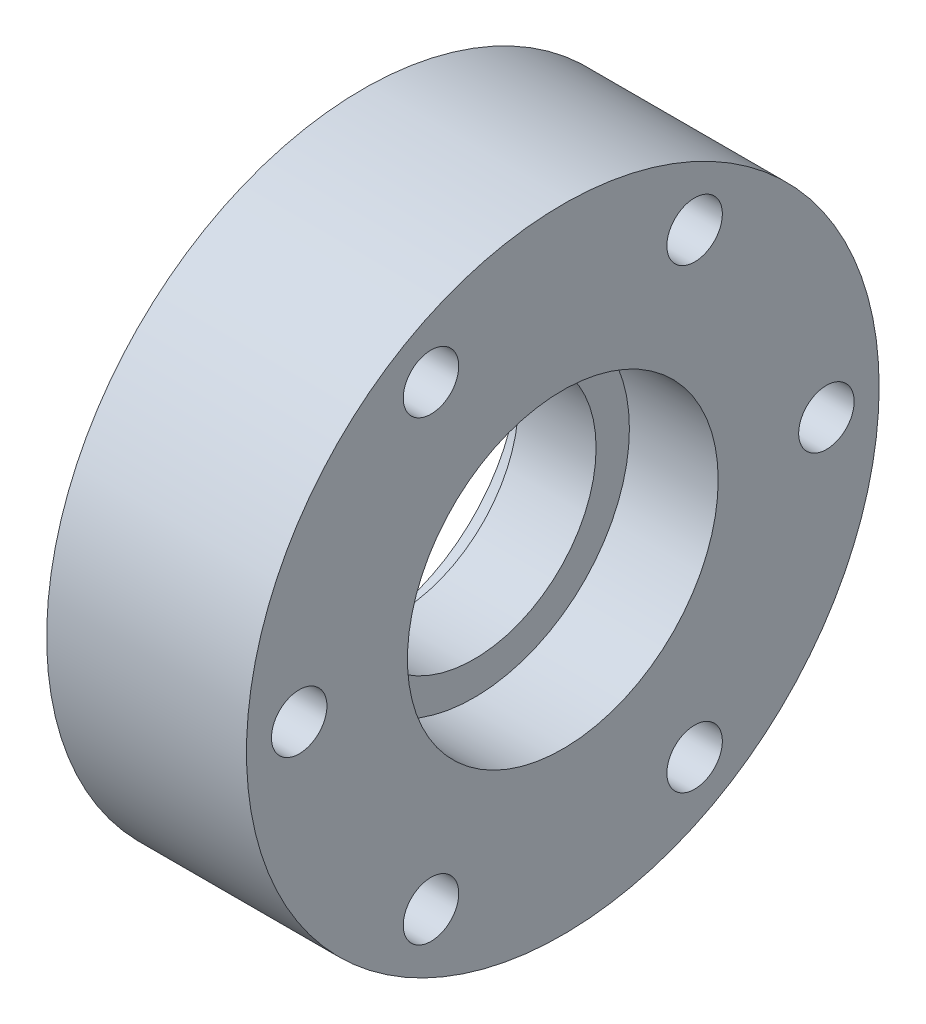
from build123d import *

# Parameters (mm, degrees)
SKETCH1_R           = 28.5
SKETCH1_R_2         = 11
SKETCH1_R_3         = 2.5
BOSS_EXTRUDE1_DEPTH = 18
CUT_EXTRUDE1_START  = -8
SKETCH2_R           = 14
SKETCH2_R_2         = 11
CUT_EXTRUDE1_DEPTH  = 8
SKETCH3_R           = 14
SKETCH3_R_2         = 11
CUT_EXTRUDE2_DEPTH  = 3


with BuildPart() as part:
    # Sketch1 → Boss-Extrude1 (new body)
    with BuildSketch(Plane(origin=(0, 0, 0), x_dir=(0, 0, -1), z_dir=(1, 0, 0))):
        Circle(SKETCH1_R)
        Circle(SKETCH1_R_2, mode=Mode.SUBTRACT)
        with Locations((-23.75, 0)):
            Circle(SKETCH1_R_3, mode=Mode.SUBTRACT)
        with Locations((-11.875, 20.56810334)):
            Circle(SKETCH1_R_3, mode=Mode.SUBTRACT)
        with Locations((11.875, 20.56810334)):
            Circle(SKETCH1_R_3, mode=Mode.SUBTRACT)
        with Locations((23.75, 0)):
            Circle(SKETCH1_R_3, mode=Mode.SUBTRACT)
        with Locations((11.875, -20.56810334)):
            Circle(SKETCH1_R_3, mode=Mode.SUBTRACT)
        with Locations((-11.875, -20.56810334)):
            Circle(SKETCH1_R_3, mode=Mode.SUBTRACT)
    extrude(amount=BOSS_EXTRUDE1_DEPTH)

    # Sketch2 → Cut-Extrude1 (cut)
    with BuildSketch(Plane(origin=(18, 0, 0), x_dir=(0, 0, -1), z_dir=(1, 0, 0)).offset(CUT_EXTRUDE1_START)):
        Circle(SKETCH2_R)
        Circle(SKETCH2_R_2, mode=Mode.SUBTRACT)
    extrude(amount=CUT_EXTRUDE1_DEPTH, mode=Mode.SUBTRACT)

    # Sketch3 → Cut-Extrude2 (cut)
    with BuildSketch(Plane.ZY):
        with Locations(Location((0, 0, 0), (0, 0, 180))):
            Circle(SKETCH3_R)
        Circle(SKETCH3_R_2, mode=Mode.SUBTRACT)
    extrude(amount=-CUT_EXTRUDE2_DEPTH, mode=Mode.SUBTRACT)


solid = part.part
